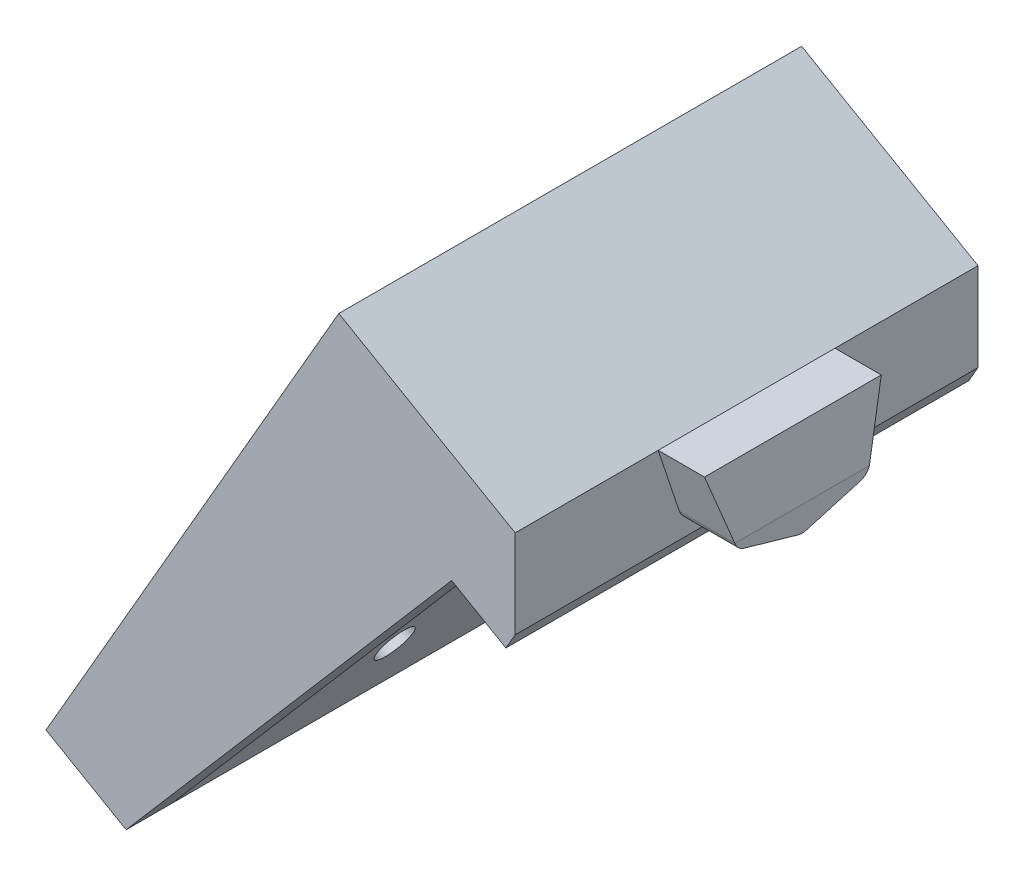
from build123d import *

# Parameters (mm, degrees)
BOSS_EXTRUDE1_DEPTH      = 6
FILLET1_R                = 1.5
BOSS_EXTRUDE2_DEPTH      = 25
BOSS_EXTRUDE2_DEPTH_BACK = 25
CUT_EXTRUDE1_DEPTH       = 87.306907839
BOSS_EXTRUDE3_DEPTH      = 2
F_4_0_4_DIAMETER_HOLE1_D = 4
SKETCH15_R               = 3.75
CUT_EXTRUDE2_DEPTH       = 3
SKETCH16_W               = 5
SKETCH16_H               = 53
BOSS_EXTRUDE4_DEPTH      = 10
CUT_EXTRUDE3_DEPTH       = 87.525968801
CUT_EXTRUDE3_DEPTH_BACK  = 10


with BuildPart() as part:
    # Sketch1 → Boss-Extrude1 (new body)
    with BuildSketch(Plane(origin=(0, 0, 0), x_dir=(0, 0, -1), z_dir=(1, 0, 0))):
        Polygon((-9.55, 0), (9.55, 0), (7.017409876, -7.588543158), (0, -9.6), (-7.017409876, -7.588543158), align=None)
    extrude(amount=BOSS_EXTRUDE1_DEPTH)

    # Fillet1
    fillet1_edges = [part.edges().sort_by_distance(p)[0] for p in [
        (3, -7.588543158, -7.017409876),
        (3, -9.6, 0),
        (3, -7.588543158, 7.017409876),
    ]]
    fillet(fillet1_edges, radius=FILLET1_R)

    # Sketch2 → Boss-Extrude2 (add, two sides: drawn at the far end of the back side and taken through both)
    with BuildSketch(Plane.XY.offset(-BOSS_EXTRUDE2_DEPTH_BACK)):
        Polygon((0, 0), (-19.052558883, 11), (-50.683324779, -43.786093614), (-42.023070741, -48.786093614), (-14.523070741, -1.154696406), (0, -9.539595208), align=None)
    extrude(amount=BOSS_EXTRUDE2_DEPTH + BOSS_EXTRUDE2_DEPTH_BACK)

    # Sketch10 → Cut-Extrude1 (cut, through all)
    with BuildSketch(Plane.XY.offset(25)):
        Polygon((6, 0), (6, -6.839154339), (5, 0), align=None)
    extrude(amount=-CUT_EXTRUDE1_DEPTH, mode=Mode.SUBTRACT)

    # Sketch14 → Boss-Extrude3 (add)
    with BuildSketch(Plane(origin=(-4.130765896, -7.154696406, 0), x_dir=(0.8660254037844397, -0.4999999999999982, 0), z_dir=(-0.4999999999999983, -0.8660254037844398, 0))):
        Polygon((-12, 25), (-12, -25), (4.769797604, -25), (4.769797604, 0), (4.769797604, 25), align=None)
    extrude(amount=BOSS_EXTRUDE3_DEPTH)

    # Ø4.0 (4) Diameter Hole1 (through all)
    with Locations(Plane(origin=(-19.052558883, 11, 0), x_dir=(0, 0, 1), z_dir=(-0.8660254037844399, 0.4999999999999977, 0))):
        with Locations((0, -40.261531792), (0, -55.261531792)):
            Hole(F_4_0_4_DIAMETER_HOLE1_D / 2)

    # Sketch15 → Cut-Extrude2 (cut)
    with BuildSketch(Plane(origin=(-19.052558883, 11, 0), x_dir=(-0.4999999999999977, -0.8660254037844399, 0), z_dir=(-0.8660254037844399, 0.4999999999999977, 0))):
        with Locations((40.261531792, 0)):
            Circle(SKETCH15_R)
        with Locations((55.261531792, 0)):
            Circle(SKETCH15_R)
    extrude(amount=-CUT_EXTRUDE2_DEPTH, mode=Mode.SUBTRACT)

    # Sketch16 → Boss-Extrude4 (add)
    with BuildSketch(Plane(origin=(-10.392304845, 6, 0), x_dir=(0, 0, -1), z_dir=(0.8660254037844398, -0.49999999999999795, 0))):
        with Locations((-22.5, -36.761531792)):
            Rectangle(SKETCH16_W, SKETCH16_H)
    boss_extrude4 = extrude(amount=BOSS_EXTRUDE4_DEPTH)

    # Mirror1: Boss-Extrude4 across plane
    add(boss_extrude4.mirror(Plane.XY))

    # Sketch17 → Cut-Extrude3 (cut, two sides: drawn at the far end of the back side and taken through both)
    with BuildSketch(Plane.XY.offset(-20).offset(-CUT_EXTRUDE3_DEPTH_BACK)):
        Polygon((-42.023070741, -48.786093614), (-6.862816703, -7.886747213), (-33.362816703, -53.786093614), align=None)
    extrude(amount=CUT_EXTRUDE3_DEPTH + CUT_EXTRUDE3_DEPTH_BACK, mode=Mode.SUBTRACT)


solid = part.part
